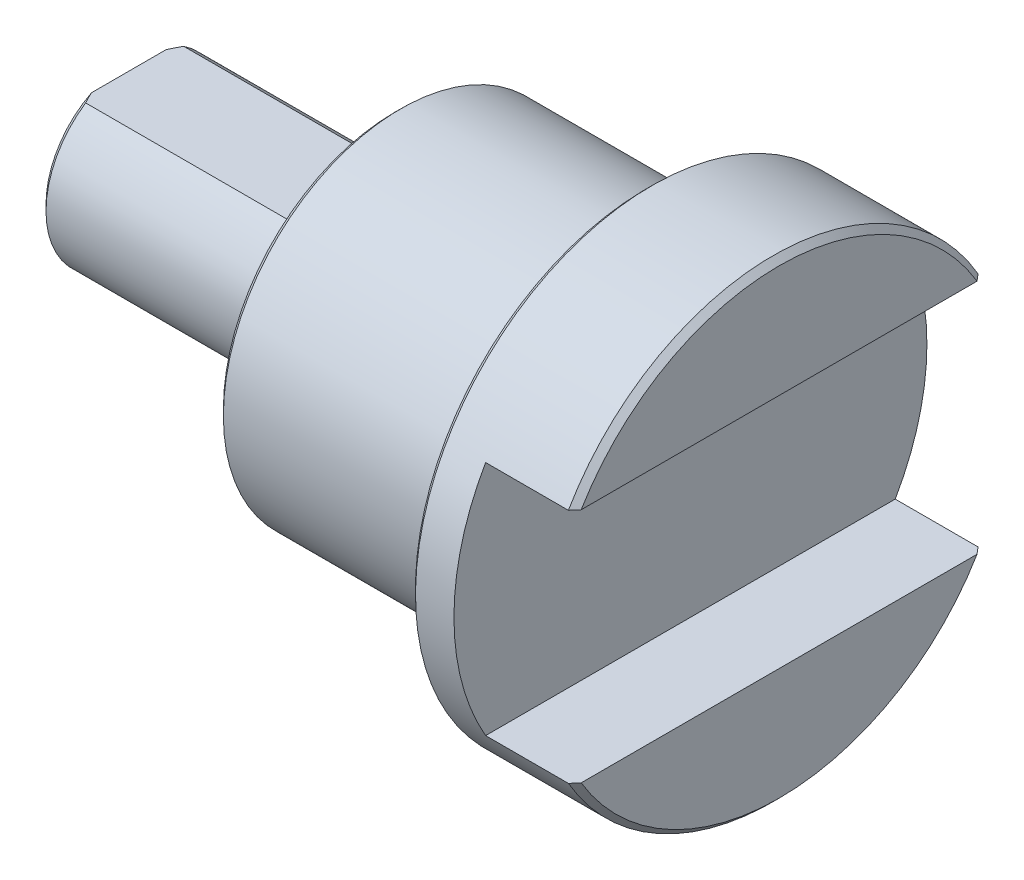
from build123d import *

# Parameters (mm, degrees)
CHANFREIN1_SIZE         = 0.2
ESQUISSE3_W             = 8
ESQUISSE3_H             = 2
ENL_V_MAT_EXTRU_2_DEPTH = 8
ESQUISSE4_W             = 3
ESQUISSE4_H             = 8
ENL_V_MAT_EXTRU_3_DEPTH = 10


with BuildPart() as part:
    # Esquisse1 → Révolution1 (revolve)
    with BuildSketch(Plane.XY, mode=Mode.PRIVATE) as r_volution1_sk:
        Polygon((-4.5, 6), (-13, 6), (-13, 3), (-22, 3), (-22, 0), (0, 0), (0, 8), (-4.5, 8), align=None)
    revolve(r_volution1_sk.sketch.rotate(Axis((0, 0, 0), (1, 0, 0)), 90), axis=Axis((0, 0, 0), (1, 0, 0)))

    # Chanfrein1
    chanfrein1_edges = [part.edges().sort_by_distance(p)[0] for p in [
        (0, 0, -8),
        (-4.5, 0, -8),
        (-13, 0, -6),
        (-22, 0, -3),
    ]]
    chamfer(chanfrein1_edges, length=CHANFREIN1_SIZE)

    # Esquisse3 → Enlèv. mat.-Extru.2 (cut)
    with BuildSketch(Plane.ZY.offset(22)):
        with Locations((0, 3.5)):
            Rectangle(ESQUISSE3_W, ESQUISSE3_H)
    extrude(amount=-ENL_V_MAT_EXTRU_2_DEPTH, mode=Mode.SUBTRACT)

    # Esquisse4 → Enlèv. mat.-Extru.3 (cut, symmetric)
    with BuildSketch(Plane.XY):
        with Locations((-1.5, 0)):
            Rectangle(ESQUISSE4_W, ESQUISSE4_H)
    extrude(amount=ENL_V_MAT_EXTRU_3_DEPTH, both=True, mode=Mode.SUBTRACT)


solid = part.part
